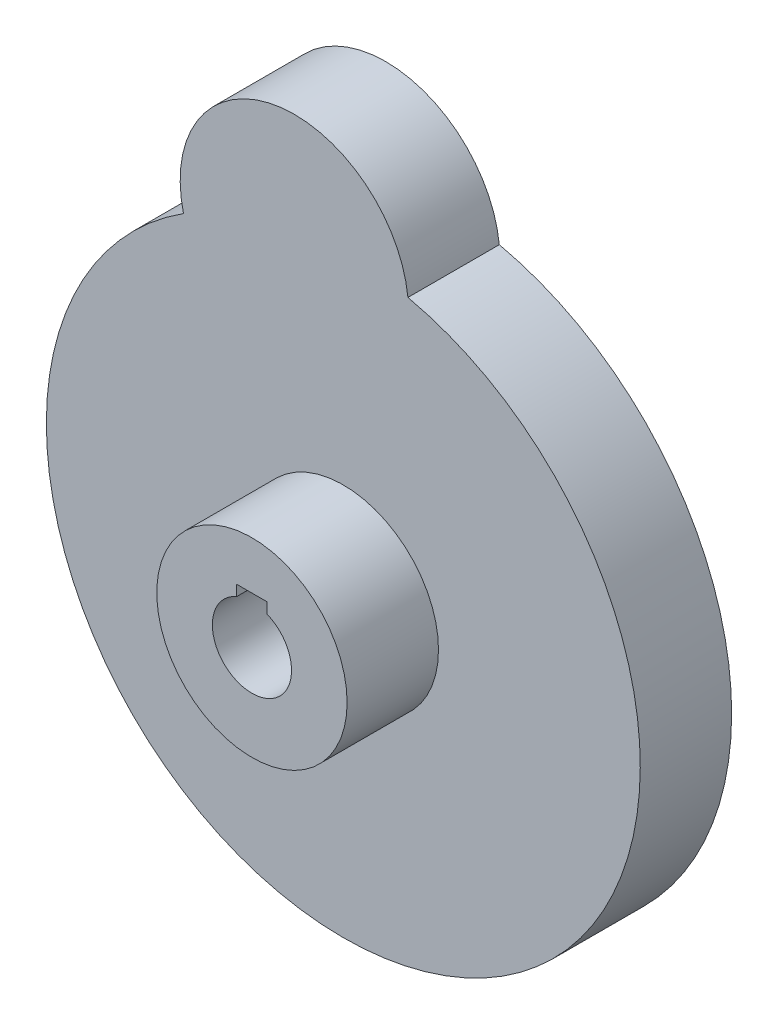
from build123d import *

# Parameters (mm, degrees)
BOSS_EXTRUDE1_DEPTH      = 6
BOSS_EXTRUDE1_DEPTH_BACK = 6
BOSS_EXTRUDE2_DEPTH      = 18
BOSS_EXTRUDE2_DEPTH_BACK = 18
SKETCH1_4_R              = 12.5


with BuildPart() as part:
    # Sketch1 → Boss-Extrude1 (new, two sides: drawn at the far end of the back side and taken through both)
    with BuildSketch(Plane.XY.offset(-BOSS_EXTRUDE1_DEPTH_BACK)):
        with BuildLine():
            ThreePointArc((-20.993816965, 32.86730365), (6.772278929, -38.407502367), (8.486454979, 38.065470993))
            ThreePointArc((8.486454979, 38.065470993), (-9.029705239, 51.210003157), (-20.993816965, 32.86730365))
        make_face()
        with BuildLine():
            Line((-2, 6.2), (2, 6.2))
            Line((2, 6.2), (2, 4.8))
            ThreePointArc((2, 4.8), (0, -5.2), (-2, 4.8))
            Line((-2, 4.8), (-2, 6.2))
        make_face(mode=Mode.SUBTRACT)
    extrude(amount=BOSS_EXTRUDE1_DEPTH + BOSS_EXTRUDE1_DEPTH_BACK)

    # Sketch1<4> → Boss-Extrude2 (add, two sides: drawn at the far end of the back side and taken through both)
    with BuildSketch(Plane.XY.offset(-BOSS_EXTRUDE2_DEPTH_BACK)):
        Circle(SKETCH1_4_R)
        with BuildLine():
            Line((-2, 4.8), (-2, 6.2))
            Line((-2, 6.2), (2, 6.2))
            Line((2, 6.2), (2, 4.8))
            ThreePointArc((2, 4.8), (4.326661531, 2.88444102), (5.2, 0))
            ThreePointArc((5.2, 0), (-2.88444102, -4.326661531), (-2, 4.8))
        make_face(mode=Mode.SUBTRACT)
    extrude(amount=BOSS_EXTRUDE2_DEPTH + BOSS_EXTRUDE2_DEPTH_BACK)


solid = part.part
